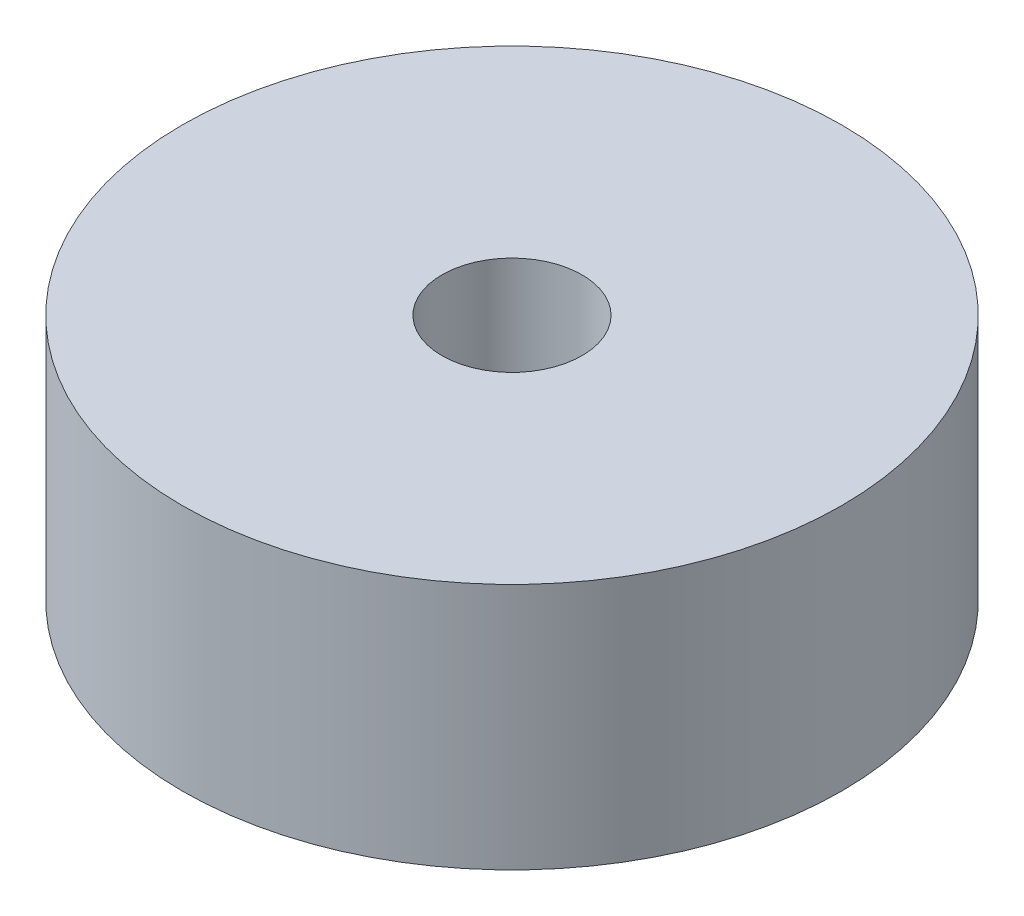
from build123d import *

# Parameters (mm, degrees)
SKETCH_1_R      = 8
SKETCH_1_R_2    = 1.7
EXTRUDE_1_DEPTH = 6


with BuildPart() as part:
    # 草图1 → 凸台-拉伸1 (new body)
    with BuildSketch(Plane(origin=(0, 0, 0), x_dir=(1, 0, 0), z_dir=(0, 1, 0))):
        with Locations(Location((0, 0, 0), (0, 0, 270))):
            Circle(SKETCH_1_R)
        with Locations(Location((0, 0, 0), (0, 0, 270))):
            Circle(SKETCH_1_R_2, mode=Mode.SUBTRACT)
    extrude(amount=EXTRUDE_1_DEPTH)


solid = part.part
